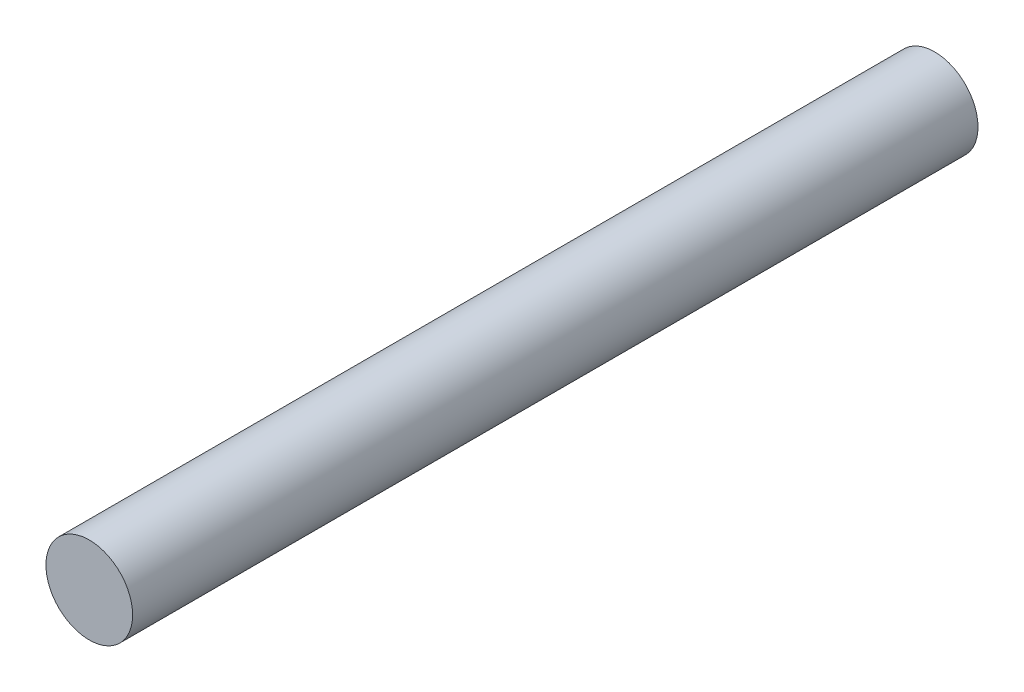
from build123d import *

# Parameters (mm, degrees)
SKETCH1_R           = 4
BOSS_EXTRUDE1_DEPTH = 78


with BuildPart() as part:
    # Sketch1 → Boss-Extrude1 (new body)
    with BuildSketch(Plane.XY):
        Circle(SKETCH1_R)
    extrude(amount=BOSS_EXTRUDE1_DEPTH)


solid = part.part
